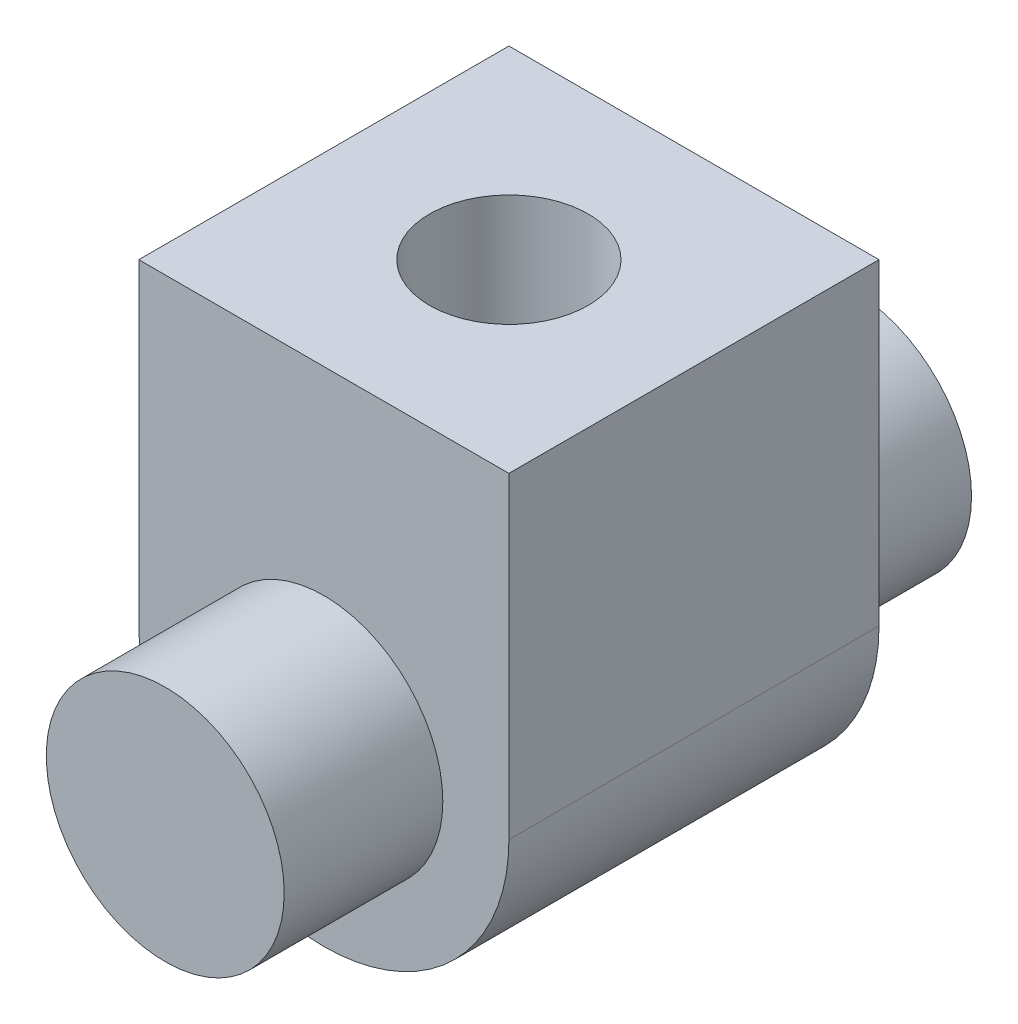
from build123d import *

# Parameters (mm, degrees)
EXTRUDE_1_DEPTH     = 7
SKETCH_3_R          = 2.25
EXTRUDE_2_DEPTH     = 3
EXTRUDE_START       = 3
SKETCH_4_R          = 2.25
EXTRUDE_3_DEPTH     = 3
SKETCH_5_R          = 1.5
CUT_EXTRUDE_4_DEPTH = 5


with BuildPart() as part:
    # 草圖1 → 伸長1 (new body)
    with BuildSketch(Plane.XY):
        with BuildLine():
            Line((-3.5, 0), (-3.5, 6))
            Line((-3.5, 6), (3.5, 6))
            Line((3.5, 6), (3.5, 0))
            ThreePointArc((3.5, 0), (0, -3.5), (-3.5, 0))
        make_face()
    extrude(amount=EXTRUDE_1_DEPTH)

    # 草圖3 → 伸長2 (add)
    with BuildSketch(Plane.XY.offset(7)):
        Circle(SKETCH_3_R)
    extrude(amount=EXTRUDE_2_DEPTH)

    # 草圖4 → 伸長3 (add)
    with BuildSketch(Plane(origin=(0, 0, 0), x_dir=(-1, 0, 0), z_dir=(0, 0, -1)).offset(EXTRUDE_START)):
        with Locations(Location((0, 0, 0), (0, 0, 180))):
            Circle(SKETCH_4_R)
    extrude(amount=-EXTRUDE_3_DEPTH)

    # 草圖5 → 伸長4 (cut)
    with BuildSketch(Plane(origin=(0, 6, 0), x_dir=(1, 0, 0), z_dir=(0, 1, 0))):
        with Locations(Location((0, -3.5, 0), (0, 0, 270))):
            Circle(SKETCH_5_R)
    extrude(amount=-CUT_EXTRUDE_4_DEPTH, mode=Mode.SUBTRACT)


solid = part.part
